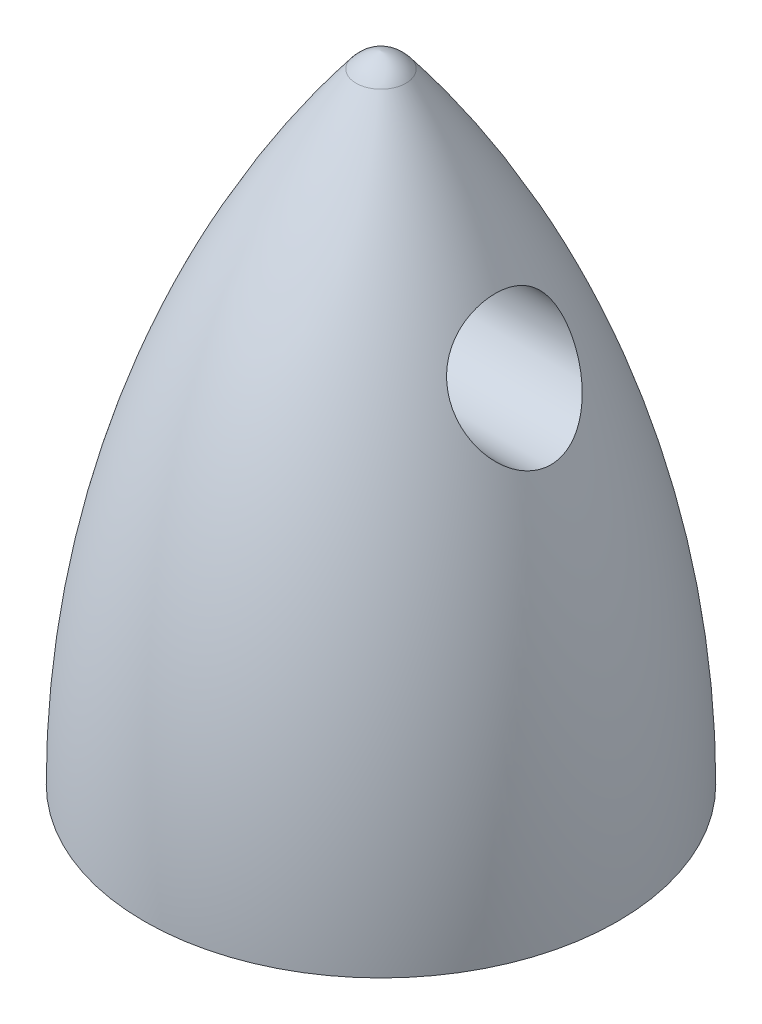
from build123d import *

# Parameters (mm, degrees)
SKETCH2_R               = 2.15
CUT_EXTRUDE1_DEPTH      = 8.128
CUT_EXTRUDE2_DEPTH      = 18.856136524
CUT_EXTRUDE2_DEPTH_BACK = 18.856136524
SKETCH3_R               = 1.5


with BuildPart() as part:
    # Sketch1 → Revolve1 (revolve)
    with BuildSketch(Plane(origin=(0, 0, 0), x_dir=(0, 0, -1), z_dir=(1, 0, 0))):
        with BuildLine():
            Line((0, 0), (5.885, 0))
            ThreePointArc((5.885, 0), (4.532364818, 8.143726552), (0.619716175, 15.412913899))
            ThreePointArc((0.619716175, 15.412913899), (0.344540977, 15.661253347), (0, 15.797947842))
            Line((0, 15.797947842), (0, 0))
        make_face()
    revolve(axis=Axis((0, 0, 0), (0, 1, 0)))

    # Sketch2 → Cut-Extrude1 (cut)
    with BuildSketch(Plane.XZ):
        with Locations(Location((0, 0, 0), (0, 0, 270))):
            Circle(SKETCH2_R)
    extrude(amount=-CUT_EXTRUDE1_DEPTH, mode=Mode.SUBTRACT)

    # Sketch3 → Cut-Extrude2 (cut, two sides: drawn at the far end of the back side and taken through both)
    with BuildSketch(Plane(origin=(0, 0, 0), x_dir=(0, 0, -1), z_dir=(1, 0, 0)).offset(-CUT_EXTRUDE2_DEPTH_BACK)):
        with Locations(Location((0, 10.5, 0), (0, 0, 39.095224415))):
            Circle(SKETCH3_R)
    extrude(amount=CUT_EXTRUDE2_DEPTH + CUT_EXTRUDE2_DEPTH_BACK, mode=Mode.SUBTRACT)


solid = part.part
